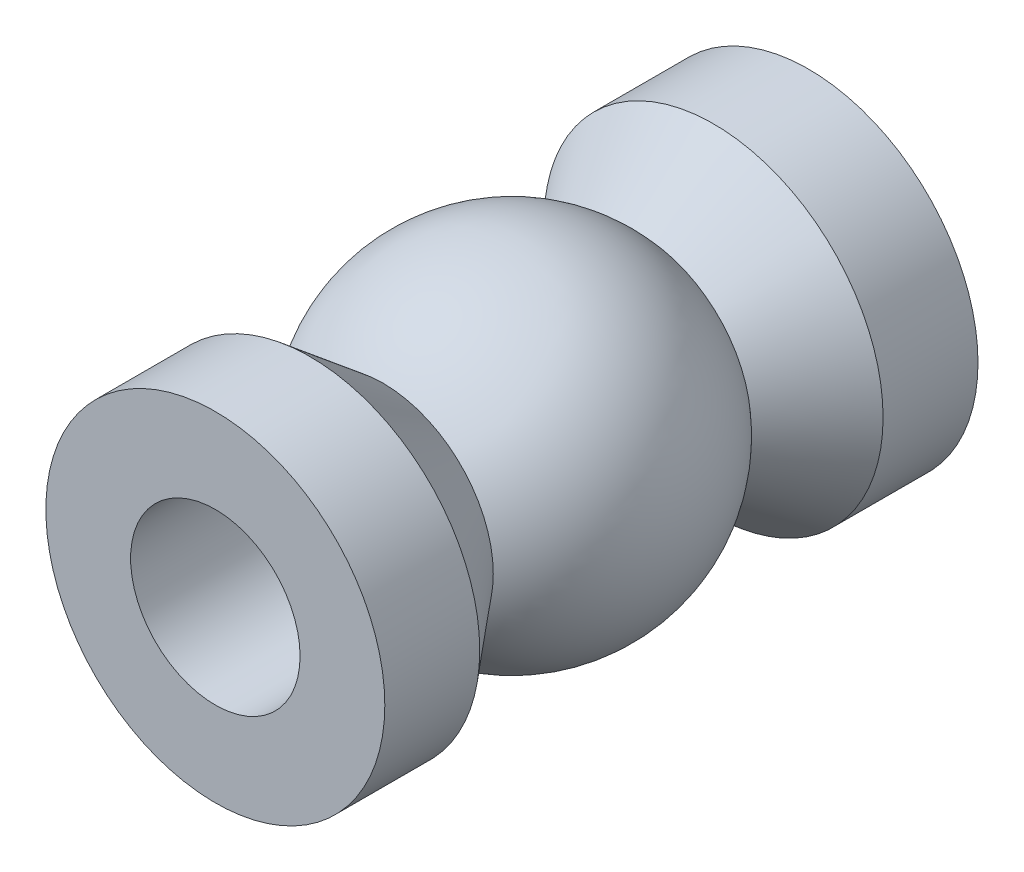
from build123d import *


with BuildPart() as part:
    # Sketch1 → Revolve1 (revolve)
    with BuildSketch(Plane(origin=(0, 0, 0), x_dir=(0, 0, -1), z_dir=(1, 0, 0)), mode=Mode.PRIVATE) as revolve1_sk:
        with BuildLine():
            Line((-11.1125, -3.175), (11.1125, -3.175))
            Line((11.1125, -3.175), (11.1125, -6.35))
            Line((11.1125, -6.35), (7.5565, -6.35))
            Line((7.5565, -6.35), (4.826, -4.12701151))
            ThreePointArc((4.826, -4.12701151), (0, -6.35), (-4.826, -4.12701151))
            Line((-4.826, -4.12701151), (-7.5565, -6.35))
            Line((-7.5565, -6.35), (-11.1125, -6.35))
            Line((-11.1125, -6.35), (-11.1125, -3.175))
        make_face()
    revolve(revolve1_sk.sketch.rotate(Axis((0, 0, -0.069344774), (0, 0, -1)), 270), axis=Axis((0, 0, -0.069344774), (0, 0, -1)))


solid = part.part
